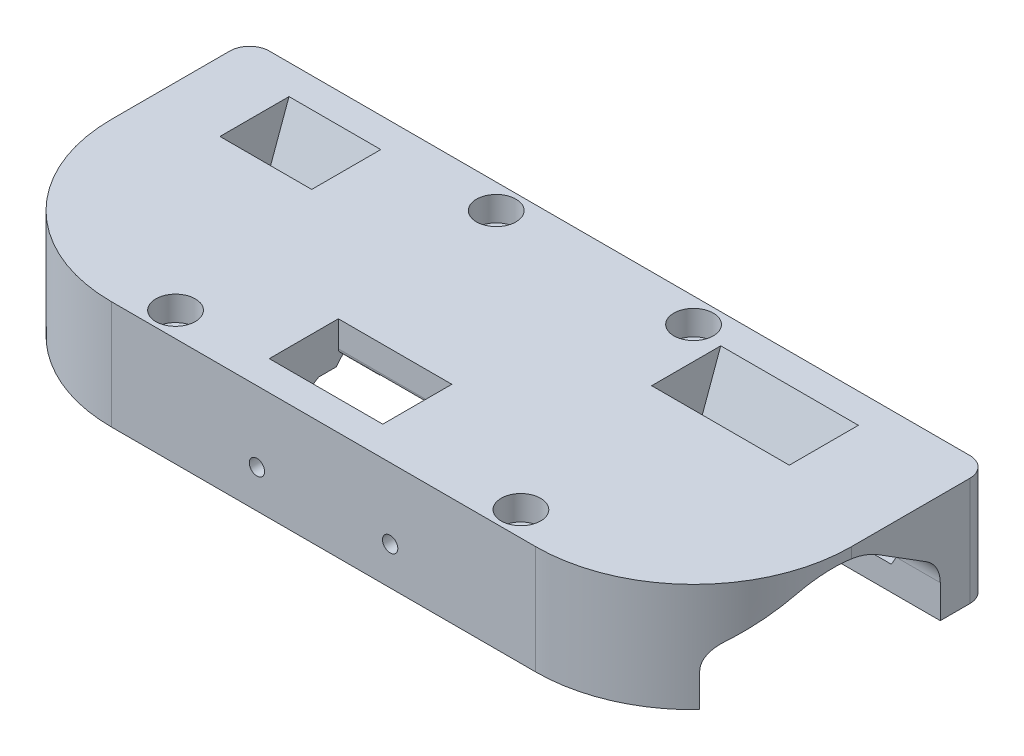
from build123d import *

# Parameters (mm, degrees)
BOSS_EXTRUDE1_DEPTH            = 75
BOSS_EXTRUDE1_DEPTH_BACK       = 75
FILLET1_R                      = 32
FILLET2_R                      = 4
SKETCH2_R                      = 1.55
CUT_EXTRUDE1_DEPTH             = 30
SKETCH3_R                      = 1.55
CUT_EXTRUDE2_DEPTH             = 30
CUT_EXTRUDE4_DEPTH             = 25
CUT_EXTRUDE4_DEPTH_BACK        = 3.4
SKETCH6_R                      = 2.1
CUT_EXTRUDE5_DEPTH             = 84.719770816
CBORE_FOR_M4_SHCS1_D           = 4.5
CBORE_FOR_M4_SHCS1_CBORE_D     = 8
CBORE_FOR_M4_SHCS1_CBORE_DEPTH = 5
BOSS_EXTRUDE2_DEPTH            = 12
CUT_EXTRUDE3_DEPTH             = 25
CUT_EXTRUDE3_DEPTH_BACK        = 3.4
BOSS_EXTRUDE3_START            = -87.5
BOSS_EXTRUDE3_DEPTH            = 12
BOSS_EXTRUDE4_DEPTH            = 12
SKETCH14_W                     = 12
SKETCH14_H                     = 10
CUT_EXTRUDE8_DEPTH             = 84.719770816
SKETCH15_W                     = 6.6
SKETCH15_H                     = 10
SKETCH15_W_2                   = 11
SKETCH15_W_3                   = 15.9
CUT_EXTRUDE9_DEPTH             = 84.719770816
FILLET3_R                      = 1
CHAMFER1_SIZE                  = 4
CHAMFER1_SIZE2                 = 10.989909678


with BuildPart() as part:
    # Sketch1 → Boss-Extrude1 (new, two sides: drawn at the far end of the back side and taken through both)
    with BuildSketch(Plane(origin=(0, 0, 0), x_dir=(0, 0, -1), z_dir=(1, 0, 0)).offset(-BOSS_EXTRUDE1_DEPTH_BACK)):
        with BuildLine():
            Line((-30, -6), (-20, -6))
            Line((-20, -6), (-20, 0.676635828))
            ThreePointArc((-20, 0.676635828), (-19.248641632, 3.583827087), (-17.182746328, 5.762904186))
            Line((-17.182746328, 5.762904186), (-7.4264081, 11.867959502))
            ThreePointArc((-7.4264081, 11.867959502), (0, 14), (7.4264081, 11.867959502))
            Line((7.4264081, 11.867959502), (17.182746328, 5.762904186))
            ThreePointArc((17.182746328, 5.762904186), (19.248641632, 3.583827087), (20, 0.676635828))
            Line((20, 0.676635828), (20, -6))
            Line((20, -6), (30, -6))
            Line((30, -6), (30, 16))
            Line((30, 16), (-30, 16))
            Line((-30, 16), (-30, -6))
        make_face()
    extrude(amount=BOSS_EXTRUDE1_DEPTH + BOSS_EXTRUDE1_DEPTH_BACK)

    # Fillet1
    fillet1_edges = [part.edges().sort_by_distance(p)[0] for p in [
        (-75, 5, 30),
        (75, 5, 30),
    ]]
    fillet(fillet1_edges, radius=FILLET1_R)

    # Fillet2
    fillet2_edges = [part.edges().sort_by_distance(p)[0] for p in [
        (-75, 5, -30),
        (75, 5, -30),
    ]]
    fillet(fillet2_edges, radius=FILLET2_R)

    # Sketch2 → Cut-Extrude1 (cut)
    with BuildSketch(Plane(origin=(0, 0, -30), x_dir=(-1, 0, 0), z_dir=(0, 0, -1))):
        with Locations(Location((36.5, 1.7, 0), (0, 0, 90))):
            Circle(SKETCH2_R)
        with Locations(Location((63.5, 1.7, 0), (0, 0, 90))):
            Circle(SKETCH2_R)
        with Locations(Location((-36.5, 1.7, 0), (0, 0, 90))):
            Circle(SKETCH2_R)
        with Locations(Location((-63.5, 1.7, 0), (0, 0, 90))):
            Circle(SKETCH2_R)
    extrude(amount=-CUT_EXTRUDE1_DEPTH, mode=Mode.SUBTRACT)

    # Sketch3 → Cut-Extrude2 (cut)
    with BuildSketch(Plane.XY.offset(30)):
        with Locations((-13.5, 1.7)):
            Circle(SKETCH3_R)
        with Locations((13.5, 1.7)):
            Circle(SKETCH3_R)
    extrude(amount=-CUT_EXTRUDE2_DEPTH, mode=Mode.SUBTRACT)

    # Sketch5 → Cut-Extrude4 (cut, two sides: drawn at the far end of the back side and taken through both)
    with BuildSketch(Plane(origin=(0, 0, 20), x_dir=(-1, 0, 0), z_dir=(0, 0, -1)).offset(-CUT_EXTRUDE4_DEPTH_BACK)):
        Polygon((-11.91228676, 4.45), (-15.08771324, 4.45), (-16.675426481, 1.7), (-15.08771324, -1.05), (-11.91228676, -1.05), (-10.324573519, 1.7), align=None)
        Polygon((11.91228676, 4.45), (10.324573519, 1.7), (11.91228676, -1.05), (15.08771324, -1.05), (16.675426481, 1.7), (15.08771324, 4.45), align=None)
    extrude(amount=CUT_EXTRUDE4_DEPTH + CUT_EXTRUDE4_DEPTH_BACK, mode=Mode.SUBTRACT)

    # Sketch6 → Cut-Extrude5 (cut, through all)
    with BuildSketch(Plane.XZ.offset(6)):
        with Locations(Location((-20, -25, 0), (0, 0, 270))):
            Circle(SKETCH6_R)
        with Locations(Location((20, -25, 0), (0, 0, 270))):
            Circle(SKETCH6_R)
        with Locations(Location((35, 25, 0), (0, 0, 270))):
            Circle(SKETCH6_R)
        with Locations(Location((-35, 25, 0), (0, 0, 270))):
            Circle(SKETCH6_R)
    extrude(amount=-CUT_EXTRUDE5_DEPTH, mode=Mode.SUBTRACT)

    # CBORE for M4 SHCS1 (through all)
    with Locations(Plane(origin=(0, 16, 0), x_dir=(1, 0, 0), z_dir=(0, 1, 0))):
        with Locations((-20, 25), (20, 25), (35, -25), (-35, -25)):
            CounterBoreHole(CBORE_FOR_M4_SHCS1_D / 2, CBORE_FOR_M4_SHCS1_CBORE_D / 2, CBORE_FOR_M4_SHCS1_CBORE_DEPTH)

    # Sketch12 → Boss-Extrude2 (add)
    with BuildSketch(Plane.ZY.offset(65)):
        with BuildLine():
            Line((20, -6), (13, -6))
            Line((13, -6), (13, 0))
            ThreePointArc((13, 0), (4.088988633, 12.340185248), (-10.427718763, 7.762904186))
            Line((-10.427718763, 7.762904186), (-13.986595688, 7.762904186))
            Line((-13.986595688, 7.762904186), (-7.4264081, 11.867959502))
            ThreePointArc((-7.4264081, 11.867959502), (0, 14), (7.4264081, 11.867959502))
            Line((7.4264081, 11.867959502), (17.182746328, 5.762904186))
            ThreePointArc((17.182746328, 5.762904186), (19.248641632, 3.583827087), (20, 0.676635828))
            Line((20, 0.676635828), (20, -6))
        make_face()
    extrude(amount=-BOSS_EXTRUDE2_DEPTH)

    # Sketch4 → Cut-Extrude3 (cut, two sides: drawn at the far end of the back side and taken through both)
    with BuildSketch(Plane.XY.offset(-20).offset(-CUT_EXTRUDE3_DEPTH_BACK)):
        Polygon((-38.08771324, 4.45), (-39.675426481, 1.7), (-38.08771324, -1.05), (-34.91228676, -1.05), (-33.324573519, 1.7), (-34.91228676, 4.45), align=None)
        Polygon((-65.08771324, 4.45), (-66.675426481, 1.7), (-65.08771324, -1.05), (-61.91228676, -1.05), (-60.324573519, 1.7), (-61.91228676, 4.45), align=None)
        Polygon((34.91228676, 4.45), (33.324573519, 1.7), (34.91228676, -1.05), (38.08771324, -1.05), (39.675426481, 1.7), (38.08771324, 4.45), align=None)
        Polygon((61.91228676, 4.45), (60.324573519, 1.7), (61.91228676, -1.05), (65.08771324, -1.05), (66.675426481, 1.7), (65.08771324, 4.45), align=None)
    extrude(amount=CUT_EXTRUDE3_DEPTH + CUT_EXTRUDE3_DEPTH_BACK, mode=Mode.SUBTRACT)

    # Sketch12<2> → Boss-Extrude3 (add)
    with BuildSketch(Plane.ZY.offset(65).offset(BOSS_EXTRUDE3_START)):
        with BuildLine():
            Line((20, -6), (13, -6))
            Line((13, -6), (13, 0))
            ThreePointArc((13, 0), (4.088988633, 12.340185248), (-10.427718763, 7.762904186))
            Line((-10.427718763, 7.762904186), (-13.986595688, 7.762904186))
            Line((-13.986595688, 7.762904186), (-7.4264081, 11.867959502))
            ThreePointArc((-7.4264081, 11.867959502), (0, 14), (7.4264081, 11.867959502))
            Line((7.4264081, 11.867959502), (17.182746328, 5.762904186))
            ThreePointArc((17.182746328, 5.762904186), (19.248641632, 3.583827087), (20, 0.676635828))
            Line((20, 0.676635828), (20, -6))
        make_face()
    extrude(amount=-BOSS_EXTRUDE3_DEPTH)

    # Sketch13 → Boss-Extrude4 (add)
    with BuildSketch(Plane.ZY.offset(21)):
        with BuildLine():
            Line((-20, -6), (-13, -6))
            Line((-13, -6), (-13, 0))
            ThreePointArc((-13, 0), (-4.088988633, 12.340185248), (10.427718763, 7.762904186))
            Line((10.427718763, 7.762904186), (13.986595688, 7.762904186))
            Line((13.986595688, 7.762904186), (7.4264081, 11.867959502))
            ThreePointArc((7.4264081, 11.867959502), (0, 14), (-7.4264081, 11.867959502))
            Line((-7.4264081, 11.867959502), (-17.182746328, 5.762904186))
            ThreePointArc((-17.182746328, 5.762904186), (-19.248641632, 3.583827087), (-20, 0.676635828))
            Line((-20, 0.676635828), (-20, -6))
        make_face()
    extrude(amount=-BOSS_EXTRUDE4_DEPTH)

    # Sketch14 → Cut-Extrude8 (cut, through all)
    with BuildSketch(Plane(origin=(0, 16, 0), x_dir=(1, 0, 0), z_dir=(0, 1, 0))):
        with Locations((-48.4, 15)):
            Rectangle(SKETCH14_W, SKETCH14_H)
        with Locations((48.4, 15)):
            Rectangle(SKETCH14_W, SKETCH14_H)
        with Locations((0, -15)):
            Rectangle(SKETCH14_W, SKETCH14_H)
    extrude(amount=-CUT_EXTRUDE8_DEPTH, mode=Mode.SUBTRACT)

    # Sketch15 → Cut-Extrude9 (cut, through all)
    with BuildSketch(Plane(origin=(0, 16, 0), x_dir=(1, 0, 0), z_dir=(0, 1, 0))):
        with Locations((-57.7, 15)):
            Rectangle(SKETCH15_W, SKETCH15_H)
        with Locations((-11.5, -15)):
            Rectangle(SKETCH15_W_2, SKETCH15_H)
        with Locations((34.45, 15)):
            Rectangle(SKETCH15_W_3, SKETCH15_H)
    extrude(amount=-CUT_EXTRUDE9_DEPTH, mode=Mode.SUBTRACT)

    # Fillet3
    fillet3_edges = [part.edges().sort_by_distance(p)[0] for p in [
        (30.5, 8.306623863, -10),
        (-13, 8.306623863, 10),
        (-57, 8.306623863, -10),
    ]]
    fillet(fillet3_edges, radius=FILLET3_R)

    # Chamfer1
    chamfer1_edges = [part.edges().sort_by_distance(p)[0] for p in [
        (-51.7, 16, -20),
        (40.45, 16, -20),
        (-5.5, 16, 20),
    ]]
    chamfer1_side = [part.faces().sort_by_distance(p)[0] for p in [
        (-0.052803983, 16, -0.825167589),
    ]]
    chamfer(chamfer1_edges, length=CHAMFER1_SIZE, length2=CHAMFER1_SIZE2, reference=chamfer1_side[0])


solid = part.part
